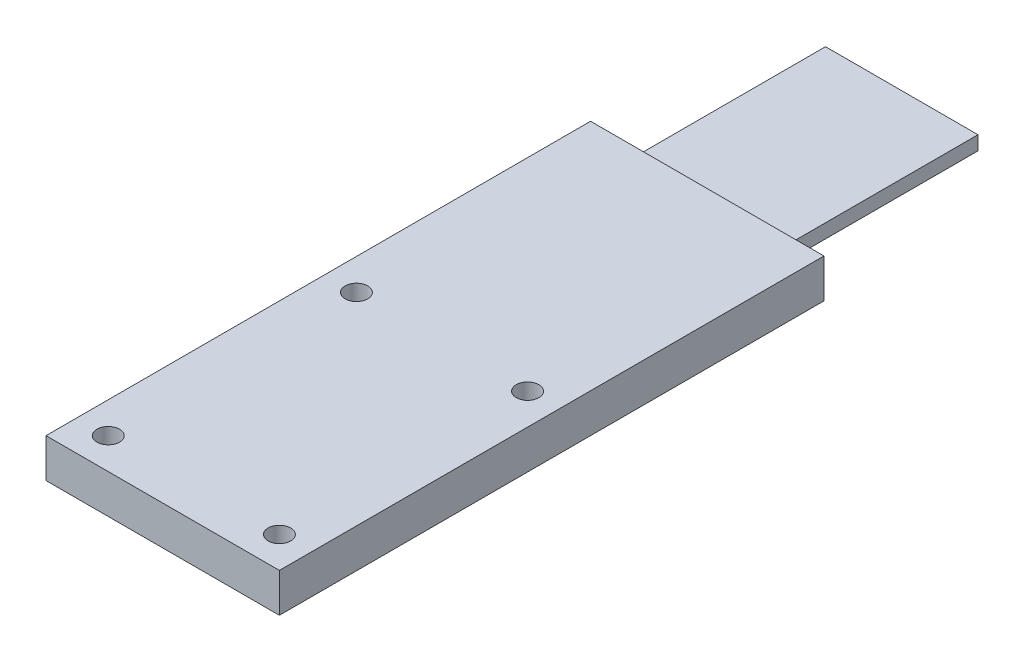
from build123d import *

# Parameters (mm, degrees)
SKETCH_1_W          = 30
SKETCH_1_H          = 5
EXTRUDE_1_DEPTH     = 70
SKETCH_2_R          = 1.45
CUT_EXTRUDE_1_DEPTH = 60
SKETCH_4_W          = 19.6
SKETCH_4_H          = 1.8
EXTRUDE_2_DEPTH     = 25


with BuildPart() as part:
    # 草图1 → 凸台-拉伸1 (new body)
    with BuildSketch(Plane.XY):
        with Locations((-15, 2.5)):
            Rectangle(SKETCH_1_W, SKETCH_1_H)
    extrude(amount=EXTRUDE_1_DEPTH)

    # 草图2 → 切除-拉伸1 (cut)
    with BuildSketch(Plane(origin=(0, 5, 0), x_dir=(1, 0, 0), z_dir=(0, 1, 0))):
        with Locations(Location((-26, -66, 0), (0, 0, 180))):
            Circle(SKETCH_2_R)
        with Locations(Location((-26, -34.1, 0), (0, 0, 180))):
            Circle(SKETCH_2_R)
        with Locations(Location((-4, -66, 0), (0, 0, 270))):
            Circle(SKETCH_2_R)
        with Locations(Location((-4, -34.1, 0), (0, 0, 270))):
            Circle(SKETCH_2_R)
    extrude(amount=-CUT_EXTRUDE_1_DEPTH, mode=Mode.SUBTRACT)

    # 草图4 → 凸台-拉伸2 (add)
    with BuildSketch(Plane(origin=(0, 0, 0), x_dir=(-1, 0, 0), z_dir=(0, 0, -1))):
        with Locations((15, 2.5)):
            Rectangle(SKETCH_4_W, SKETCH_4_H)
    extrude(amount=EXTRUDE_2_DEPTH)


solid = part.part
